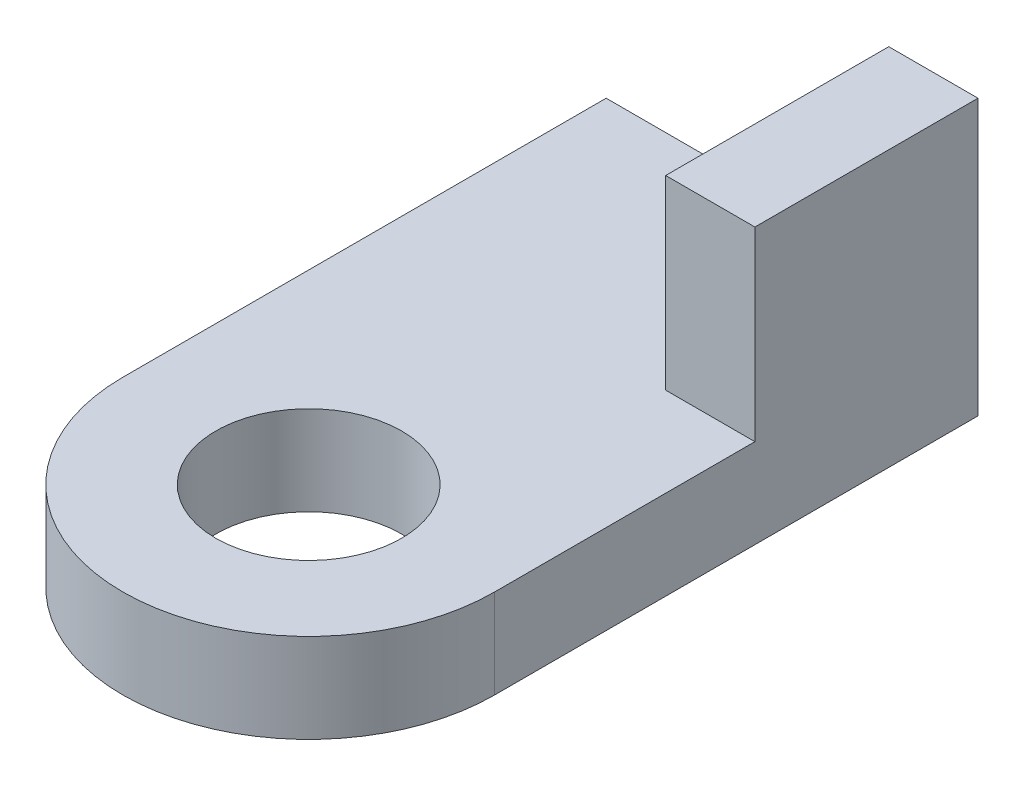
from build123d import *

# Parameters (mm, degrees)
SKETCH2_W           = 50
SKETCH2_H           = 65
BOSS_EXTRUDE1_DEPTH = 12
BOSS_EXTRUDE2_DEPTH = 12
SKETCH5_R           = 12.5
CUT_EXTRUDE1_DEPTH  = 12
SKETCH7_W           = 12
SKETCH7_H           = 30
BOSS_EXTRUDE3_DEPTH = 25


with BuildPart() as part:
    # Sketch2 → Boss-Extrude1 (new body)
    with BuildSketch(Plane(origin=(0, 0, 0), x_dir=(1, 0, 0), z_dir=(0, 1, 0))):
        with Locations((25, -32.5)):
            Rectangle(SKETCH2_W, SKETCH2_H)
    extrude(amount=BOSS_EXTRUDE1_DEPTH)

    # Sketch3 → Boss-Extrude2 (add)
    with BuildSketch(Plane(origin=(0, 12, 0), x_dir=(1, 0, 0), z_dir=(0, 1, 0))):
        with BuildLine():
            Line((0, -65), (50, -65))
            ThreePointArc((50, -65), (25, -90), (0, -65))
        make_face()
    extrude(amount=-BOSS_EXTRUDE2_DEPTH)

    # Sketch5 → Cut-Extrude1 (cut)
    with BuildSketch(Plane(origin=(0, 12, 0), x_dir=(1, 0, 0), z_dir=(0, 1, 0))):
        with Locations(Location((25, -65, 0), (0, 0, 270))):
            Circle(SKETCH5_R)
    extrude(amount=-CUT_EXTRUDE1_DEPTH, mode=Mode.SUBTRACT)

    # Sketch7 → Boss-Extrude3 (add)
    with BuildSketch(Plane(origin=(0, 12, 0), x_dir=(1, 0, 0), z_dir=(0, 1, 0))):
        with Locations((44, -15)):
            Rectangle(SKETCH7_W, SKETCH7_H)
    extrude(amount=BOSS_EXTRUDE3_DEPTH)


solid = part.part
